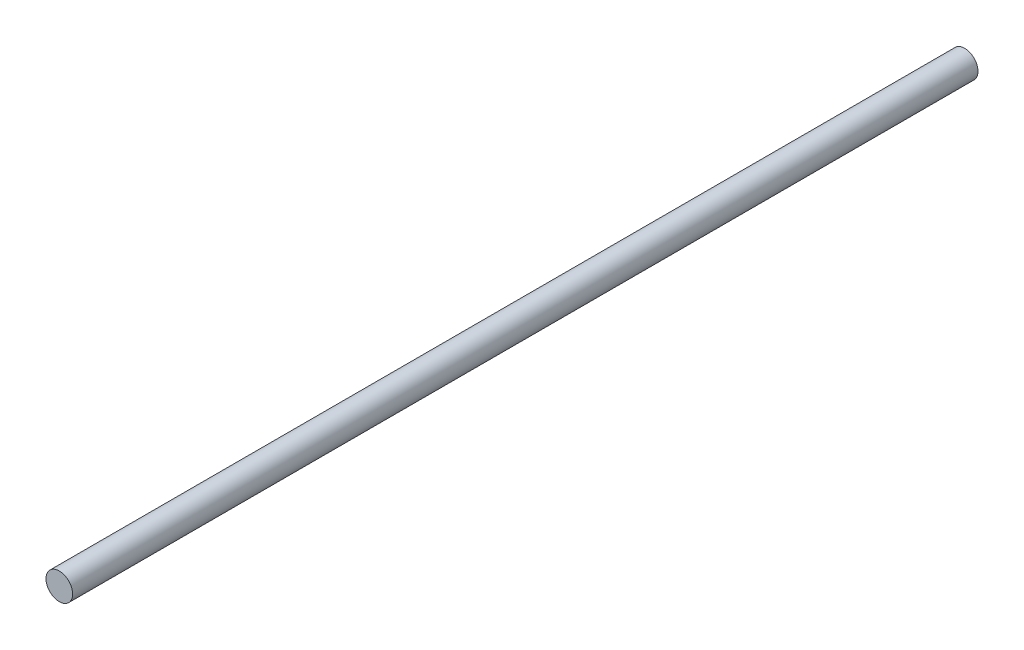
from build123d import *

# Parameters (mm, degrees)
SKETCH1_R           = 3.175
BOSS_EXTRUDE1_DEPTH = 215.9


with BuildPart() as part:
    # Sketch1 → Boss-Extrude1 (new body)
    with BuildSketch(Plane.XY):
        Circle(SKETCH1_R)
    extrude(amount=BOSS_EXTRUDE1_DEPTH)


solid = part.part
